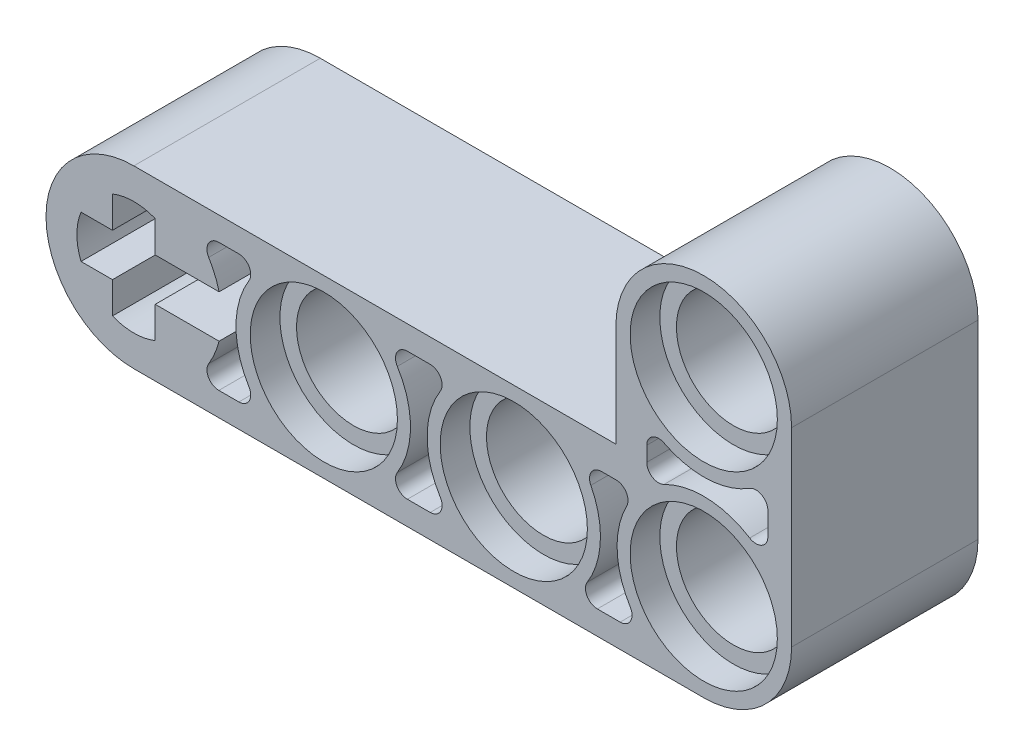
from build123d import *

# Parameters (mm, degrees)
SKETCH1_R            = 2.4
BEAM_DEPTH           = 3.925
AXLE_CUT_DEPTH       = 31.324670237
AXLE_CUT_DEPTH_BACK  = 31.324670237
SKETCH3_R            = 3.1
HOLE_SURROUND_DEPTH  = 1.25
CAVITY_CUT_DEPTH     = 3
FILLET2_R            = 0.5
FILLET2_OF_MIRROR2_R = 0.5
FILLET3_R            = 0.5


with BuildPart() as part:
    # Sketch1 → Beam (new, symmetric)
    with BuildSketch(Plane.XY):
        with BuildLine():
            Line((20.3, 3.7), (0, 3.7))
            ThreePointArc((0, 3.7), (-3.7, 0), (0, -3.7))
            Line((0, -3.7), (24, -3.7))
            ThreePointArc((24, -3.7), (26.61629509, -2.61629509), (27.7, 0))
            Line((27.7, 0), (27.7, 8))
            ThreePointArc((27.7, 8), (24, 11.7), (20.3, 8))
            Line((20.3, 8), (20.3, 3.7))
        make_face()
        with Locations((8, 0)):
            Circle(SKETCH1_R, mode=Mode.SUBTRACT)
        with Locations((16, 0)):
            Circle(SKETCH1_R, mode=Mode.SUBTRACT)
        with Locations((24, 0)):
            Circle(SKETCH1_R, mode=Mode.SUBTRACT)
        with Locations((24, 8)):
            Circle(SKETCH1_R, mode=Mode.SUBTRACT)
    extrude(amount=BEAM_DEPTH, both=True)

    # Sketch2 → Axle Cut (cut, two sides: drawn at the far end of the back side and taken through both)
    with BuildSketch(Plane.XY.offset(-AXLE_CUT_DEPTH_BACK)):
        with BuildLine():
            ThreePointArc((-0.9, -2.224859546), (0, -2.4), (0.9, -2.224859546))
            Line((0.9, -2.224859546), (0.9, -0.9))
            Line((0.9, -0.9), (3.588871689, -0.9))
            ThreePointArc((3.588871689, -0.9), (3.188981578, -1.876271967), (2.529822128, -2.7))
            Line((2.529822128, -2.7), (5.470177872, -2.7))
            ThreePointArc((5.470177872, -2.7), (4.3, 0), (5.470177872, 2.7))
            Line((5.470177872, 2.7), (2.529822128, 2.7))
            ThreePointArc((2.529822128, 2.7), (3.188981578, 1.876271967), (3.588871689, 0.9))
            Line((3.588871689, 0.9), (0.9, 0.9))
            Line((0.9, 0.9), (0.9, 2.224859546))
            ThreePointArc((0.9, 2.224859546), (0, 2.4), (-0.9, 2.224859546))
            Line((-0.9, 2.224859546), (-0.9, 0.9))
            Line((-0.9, 0.9), (-2.224859546, 0.9))
            ThreePointArc((-2.224859546, 0.9), (-2.4, 0), (-2.224859546, -0.9))
            Line((-2.224859546, -0.9), (-0.9, -0.9))
            Line((-0.9, -0.9), (-0.9, -2.224859546))
        make_face()
    extrude(amount=AXLE_CUT_DEPTH + AXLE_CUT_DEPTH_BACK, mode=Mode.SUBTRACT)

    # Sketch3 → Hole Surround (cut)
    with BuildSketch(Plane.XY.offset(3.925)):
        with Locations((24, 8)):
            Circle(SKETCH3_R)
        with Locations((24, 0)):
            Circle(SKETCH3_R)
        with Locations((16, 0)):
            Circle(SKETCH3_R)
        with Locations((8, 0)):
            Circle(SKETCH3_R)
    hole_surround = extrude(amount=-HOLE_SURROUND_DEPTH, mode=Mode.SUBTRACT)

    # Sketch4 → Cavity Cut (cut)
    with BuildSketch(Plane.XY.offset(3.925)):
        with BuildLine():
            Line((21.6, 5.25), (21.6, 2.75))
            ThreePointArc((21.6, 2.75), (24.209981249, 3.643954977), (26.7, 2.456114818))
            Line((26.7, 2.456114818), (26.7, 5.543885182))
            ThreePointArc((26.7, 5.543885182), (24.209981249, 4.356045023), (21.6, 5.25))
        make_face()
        with BuildLine():
            ThreePointArc((21.543885182, -2.7), (20.356045023, -0.209981249), (21.25, 2.4))
            Line((21.25, 2.4), (18.75, 2.4))
            ThreePointArc((18.75, 2.4), (19.643954977, -0.209981249), (18.456114818, -2.7))
            Line((18.456114818, -2.7), (21.543885182, -2.7))
        make_face()
        with BuildLine():
            ThreePointArc((13.543885182, -2.7), (12.35, 0), (13.543885182, 2.7))
            Line((13.543885182, 2.7), (10.456114818, 2.7))
            ThreePointArc((10.456114818, 2.7), (11.65, 0), (10.456114818, -2.7))
            Line((10.456114818, -2.7), (13.543885182, -2.7))
        make_face()
    cavity_cut = extrude(amount=-CAVITY_CUT_DEPTH, mode=Mode.SUBTRACT)

    # Fillet2
    fillet2_edges = [part.edges().sort_by_distance(p)[0] for p in [
        (26.7, 5.543885182, 2.425),
        (21.543885182, -2.7, 2.425),
        (13.543885182, 2.7, 2.425),
        (18.456114818, -2.7, 2.425),
        (13.543885182, -2.7, 2.425),
        (10.456114818, -2.7, 2.425),
        (10.456114818, 2.7, 2.425),
        (21.6, 2.75, 2.425),
        (26.7, 2.456114818, 2.425),
        (21.6, 5.25, 2.425),
        (18.75, 2.4, 2.425),
        (21.25, 2.4, 2.425),
    ]]
    fillet(fillet2_edges, radius=FILLET2_R)

    # Mirror2: Hole Surround, Cavity Cut across plane
    add(hole_surround.mirror(Plane.XY), mode=Mode.SUBTRACT)
    add(cavity_cut.mirror(Plane.XY), mode=Mode.SUBTRACT)

    # Fillet2 of Mirror2
    fillet2_of_mirror2_edges = [part.edges().sort_by_distance(p)[0] for p in [
        (26.7, 5.543885182, -2.425),
        (21.543885182, -2.7, -2.425),
        (13.543885182, 2.7, -2.425),
        (18.456114818, -2.7, -2.425),
        (13.543885182, -2.7, -2.425),
        (10.456114818, -2.7, -2.425),
        (10.456114818, 2.7, -2.425),
        (21.6, 2.75, -2.425),
        (26.7, 2.456114818, -2.425),
        (21.6, 5.25, -2.425),
        (18.75, 2.4, -2.425),
        (21.25, 2.4, -2.425),
    ]]
    fillet(fillet2_of_mirror2_edges, radius=FILLET2_OF_MIRROR2_R)

    # Fillet3
    fillet3_edges = [part.edges().sort_by_distance(p)[0] for p in [
        (2.529822128, -2.7, 0),
        (5.470177872, -2.7, 0),
        (5.470177872, 2.7, 0),
        (2.529822128, 2.7, 0),
    ]]
    fillet(fillet3_edges, radius=FILLET3_R)


solid = part.part
